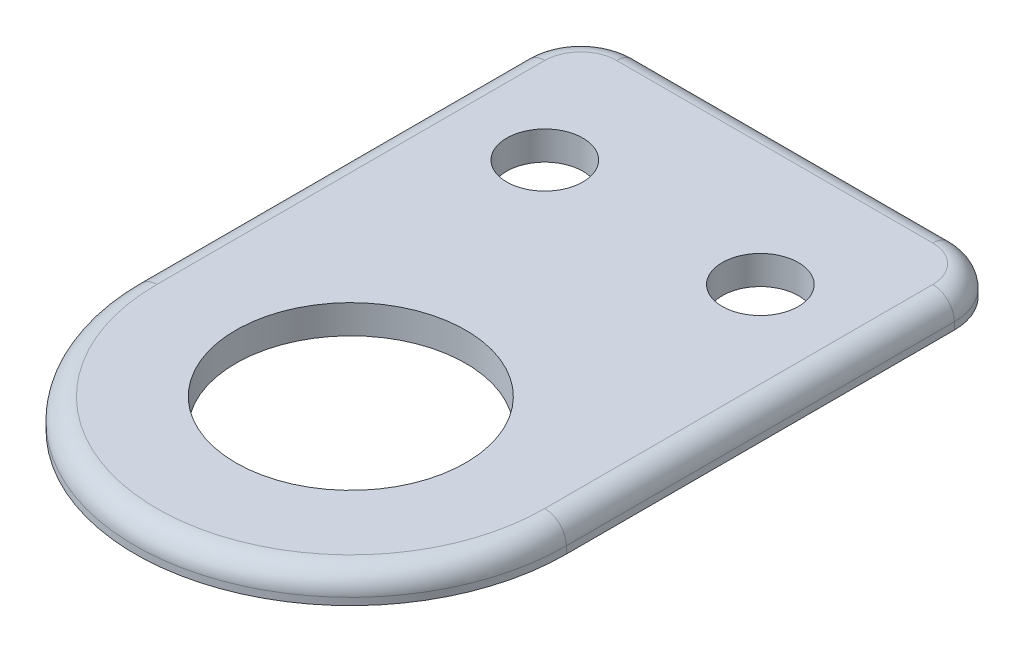
from build123d import *

# Parameters (mm, degrees)
SKETCH1_R            = 8
BOSS_EXTRUDE1_DEPTH  = 2
M5_CLEARANCE_HOLE1_D = 5.3
FILLET1_R            = 4
FILLET2_R            = 1.5


with BuildPart() as part:
    # Sketch1 → Boss-Extrude1 (new body)
    with BuildSketch(Plane(origin=(0, 0, 0), x_dir=(1, 0, 0), z_dir=(0, 1, 0))):
        with BuildLine():
            Line((-15, 0), (-15, 31))
            Line((-15, 31), (15, 31))
            Line((15, 31), (15, 0))
            ThreePointArc((15, 0), (0, -15), (-15, 0))
        make_face()
        with Locations(Location((0, 0, 0), (0, 0, 270))):
            Circle(SKETCH1_R, mode=Mode.SUBTRACT)
    extrude(amount=BOSS_EXTRUDE1_DEPTH)

    # M5 Clearance Hole1 (through all)
    with Locations(Plane(origin=(-7.5, 2, -21), x_dir=(0, 0, 1), z_dir=(0, 1, 0))):
        with Locations((0, 0), (0, 15)):
            Hole(M5_CLEARANCE_HOLE1_D / 2)

    # Fillet1
    fillet1_edges = [part.edges().sort_by_distance(p)[0] for p in [
        (-15, 1, -31),
        (15, 1, -31),
    ]]
    fillet(fillet1_edges, radius=FILLET1_R)

    # Fillet2
    fillet2_edges = [part.edges().sort_by_distance(p)[0] for p in [
        (15, 2, -13.5),
        (-15, 2, -13.5),
        (0, 2, -31),
        (-13.828427125, 2, -29.828427125),
        (13.828427125, 2, -29.828427125),
        (0, 2, 15),
    ]]
    fillet(fillet2_edges, radius=FILLET2_R)


solid = part.part
